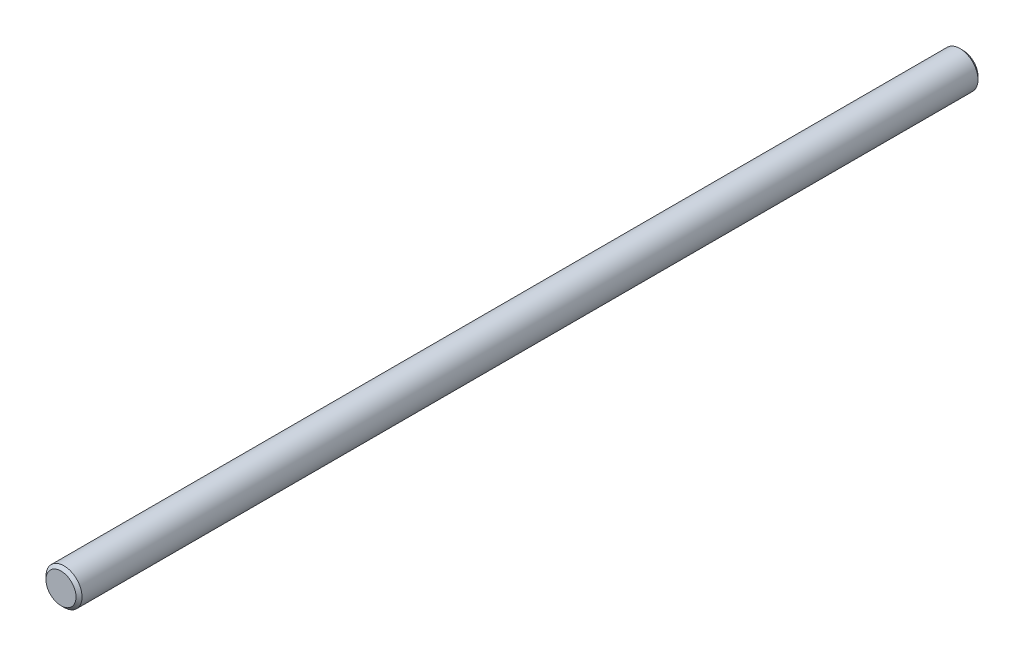
from build123d import *

# Parameters (mm, degrees)
CROQUIS1_R              = 6
SALIENTE_EXTRUIR1_DEPTH = 300
CHAFL_N1_SIZE           = 1


with BuildPart() as part:
    # Croquis1 → Saliente-Extruir1 (new body)
    with BuildSketch(Plane.XY):
        Circle(CROQUIS1_R)
    extrude(amount=SALIENTE_EXTRUIR1_DEPTH)

    # Chaflán1
    chafl_n1_edges = [part.edges().sort_by_distance(p)[0] for p in [
        (-6, 0, 0),
        (-6, 0, 300),
    ]]
    chamfer(chafl_n1_edges, length=CHAFL_N1_SIZE)


solid = part.part
